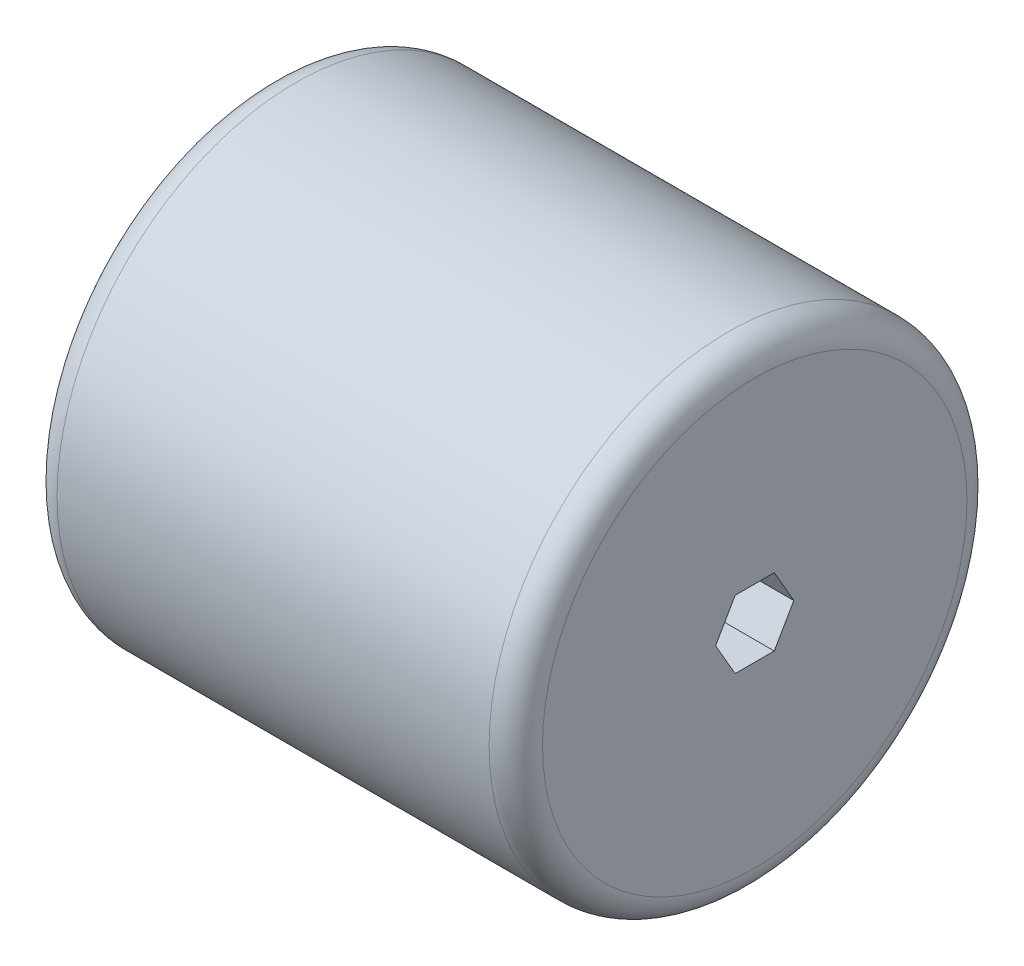
from build123d import *

# Parameters (mm, degrees)
CROQUIS1_R              = 44.77
SALIENTE_EXTRUIR1_DEPTH = 90.96
REDONDEO1_R             = 5


with BuildPart() as part:
    # Croquis1 → Saliente-Extruir1 (new body)
    with BuildSketch(Plane(origin=(0, 0, 0), x_dir=(0, 0, -1), z_dir=(1, 0, 0))):
        Circle(CROQUIS1_R)
        Polygon((7.332348419, 0), (3.666174209, 6.35), (-3.666174209, 6.35), (-7.332348419, 0), (-3.666174209, -6.35), (3.666174209, -6.35), align=None, mode=Mode.SUBTRACT)
    extrude(amount=SALIENTE_EXTRUIR1_DEPTH)

    # Redondeo1
    redondeo1_edges = [part.edges().sort_by_distance(p)[0] for p in [
        (0, 0, 44.77),
        (90.96, 0, 44.77),
    ]]
    fillet(redondeo1_edges, radius=REDONDEO1_R)


solid = part.part
